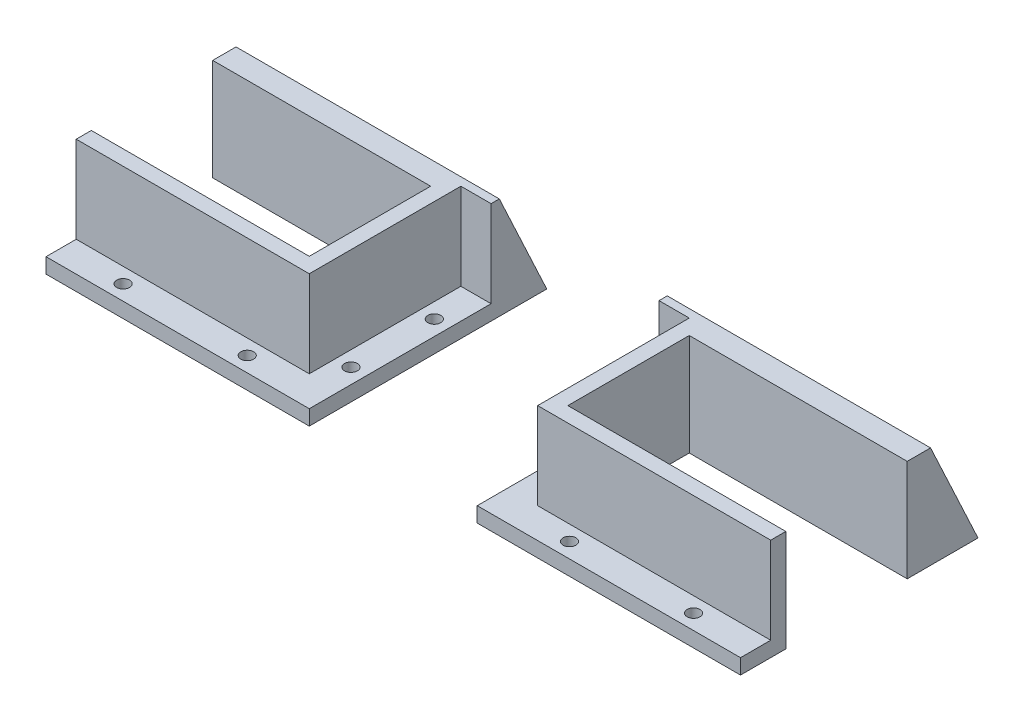
from build123d import *

# Parameters (mm, degrees)
BOSS_EXTRUDE1_DEPTH   = 21.395
BOSS_EXTRUDE1_2_DEPTH = 21.395
SKETCH2_R             = 1.35
BOSS_EXTRUDE2_DEPTH   = 3.175
SKETCH4_W             = 55.345
SKETCH4_H             = 11.705
BOSS_EXTRUDE3_DEPTH   = 21.395
CUT_EXTRUDE1_DEPTH    = 151.12566611


with BuildPart() as part:
    # Sketch1 → Boss-Extrude1 (new body)
    with BuildSketch(Plane(origin=(0, 0, 0), x_dir=(1, 0, 0), z_dir=(0, 1, 0))):
        Polygon((-73, 12.76), (-27.18, 12.76), (-27.18, -12.76), (-73, -12.76), (-73, -15.935), (-24.005, -15.935), (-24.005, 15.935), (-73, 15.935), align=None)
    extrude(amount=BOSS_EXTRUDE1_DEPTH)



with BuildPart() as body_2:
    # Sketch1 → Boss-Extrude1 2 (new body)
    with BuildSketch(Plane(origin=(0, 0, 0), x_dir=(1, 0, 0), z_dir=(0, 1, 0))):
        Polygon((73, 12.76), (27.18, 12.76), (27.18, -12.76), (73, -12.76), (73, -15.935), (24.005, -15.935), (24.005, 15.935), (73, 15.935), align=None)
    extrude(amount=BOSS_EXTRUDE1_2_DEPTH)


with BuildPart() as part_1:
    add(part.part)

    add(body_2.part)  # Boss-Extrude2 merges body 2
    # Sketch2 → Boss-Extrude2 (add)
    # profile 1 of 2: a face of its own
    with BuildSketch(Plane(origin=(0, 0, 0), x_dir=(1, 0, 0), z_dir=(0, 1, 0))):
        Polygon((-73, -15.935), (-24.005, -15.935), (-24.005, 15.935), (-17.655, 15.935), (-17.655, -22.285), (-24.005, -22.285), (-73, -22.285), align=None)
        with Locations(Location((-20.83, -10.34875, 0), (0, 0, 270))):
            Circle(SKETCH2_R, mode=Mode.SUBTRACT)
        with Locations(Location((-20.83, 7.17375, 0), (0, 0, 270))):
            Circle(SKETCH2_R, mode=Mode.SUBTRACT)
        with Locations(Location((-59.9575, -19.11, 0), (0, 0, 270))):
            Circle(SKETCH2_R, mode=Mode.SUBTRACT)
        with Locations(Location((-33.8725, -19.11, 0), (0, 0, 270))):
            Circle(SKETCH2_R, mode=Mode.SUBTRACT)
    # profile 2 of 2: a face of its own
    with BuildSketch(Plane(origin=(0, 0, 0), x_dir=(1, 0, 0), z_dir=(0, 1, 0))):
        Polygon((73, -15.935), (24.005, -15.935), (24.005, 15.935), (17.655, 15.935), (17.655, -22.285), (24.005, -22.285), (73, -22.285), align=None)
        with Locations(Location((20.83, 7.17375, 0), (0, 0, 270))):
            Circle(SKETCH2_R, mode=Mode.SUBTRACT)
        with Locations(Location((20.83, -10.34875, 0), (0, 0, 270))):
            Circle(SKETCH2_R, mode=Mode.SUBTRACT)
        with Locations(Location((33.8725, -19.11, 0), (0, 0, 270))):
            Circle(SKETCH2_R, mode=Mode.SUBTRACT)
        with Locations(Location((59.9575, -19.11, 0), (0, 0, 270))):
            Circle(SKETCH2_R, mode=Mode.SUBTRACT)
    extrude(amount=BOSS_EXTRUDE2_DEPTH)

    # Sketch4 → Boss-Extrude3 (add)
    with BuildSketch(Plane(origin=(0, 0, 0), x_dir=(1, 0, 0), z_dir=(0, 1, 0))):
        with Locations((-45.3275, 21.7875)):
            Rectangle(SKETCH4_W, SKETCH4_H)
        with Locations((45.3275, 21.7875)):
            Rectangle(SKETCH4_W, SKETCH4_H)
    extrude(amount=BOSS_EXTRUDE3_DEPTH)

    # Sketch5 → Cut-Extrude1 (cut, through all)
    with BuildSketch(Plane.ZY.offset(73)):
        Polygon((-27.64, 21.395), (-27.64, 0), (-17.663347654, 21.395), align=None)
    extrude(amount=-CUT_EXTRUDE1_DEPTH, mode=Mode.SUBTRACT)


solid = part_1.part
